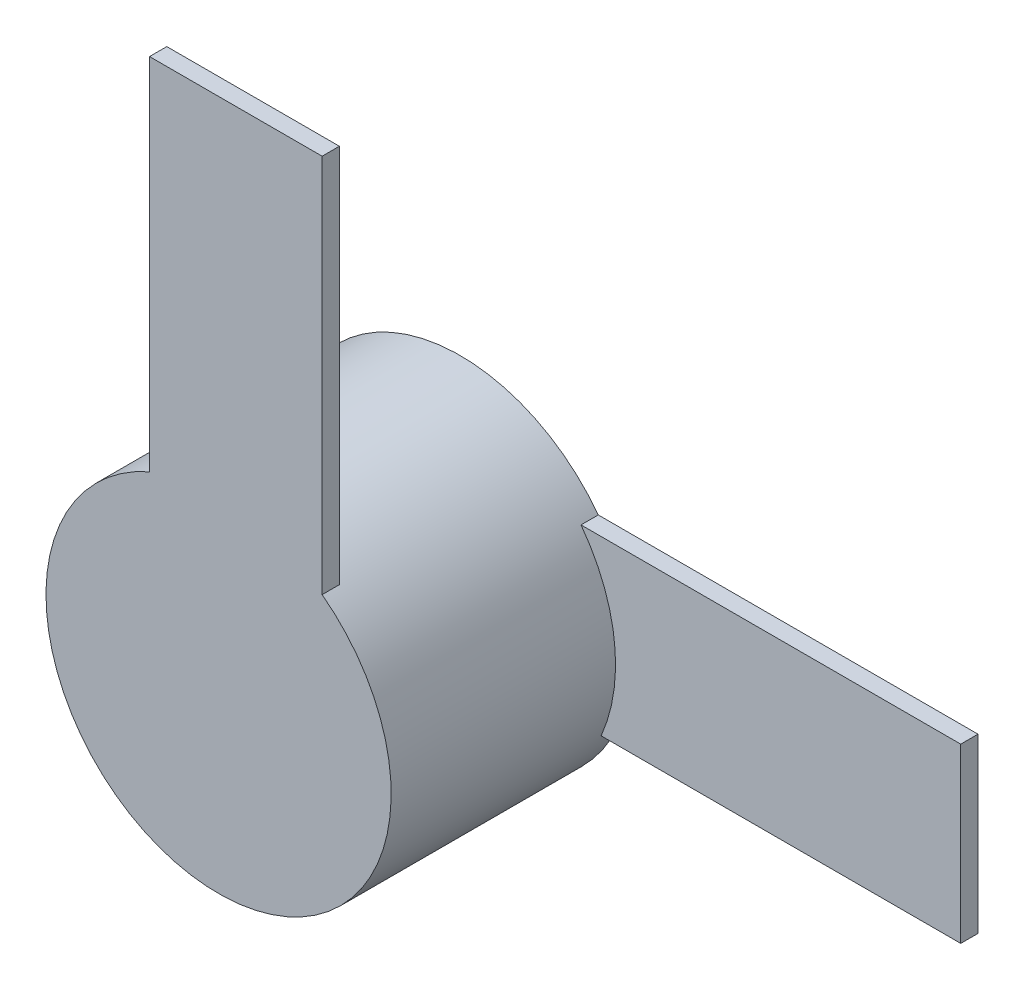
from build123d import *

# Parameters (mm, degrees)
SKETCH1_R           = 50
BOSS_EXTRUDE1_DEPTH = 70
SKETCH2_W           = 50
SKETCH2_H           = 5
BOSS_EXTRUDE2_DEPTH = 150
SKETCH4_W           = 5
SKETCH4_H           = 50
BOSS_EXTRUDE3_DEPTH = 150


with BuildPart() as part:
    # Sketch1 → Boss-Extrude1 (new body)
    with BuildSketch(Plane.XY):
        Circle(SKETCH1_R)
    extrude(amount=BOSS_EXTRUDE1_DEPTH)

    # Sketch2 → Boss-Extrude2 (add)
    with BuildSketch(Plane(origin=(0, 0, 0), x_dir=(1, 0, 0), z_dir=(0, 1, 0))):
        with Locations((5, -67.5)):
            Rectangle(SKETCH2_W, SKETCH2_H)
    extrude(amount=BOSS_EXTRUDE2_DEPTH)

    # Sketch4 → Boss-Extrude3 (add)
    with BuildSketch(Plane(origin=(0, 0, 0), x_dir=(0, 0, -1), z_dir=(1, 0, 0))):
        with Locations((-2.5, 5)):
            Rectangle(SKETCH4_W, SKETCH4_H)
    extrude(amount=BOSS_EXTRUDE3_DEPTH)


solid = part.part
